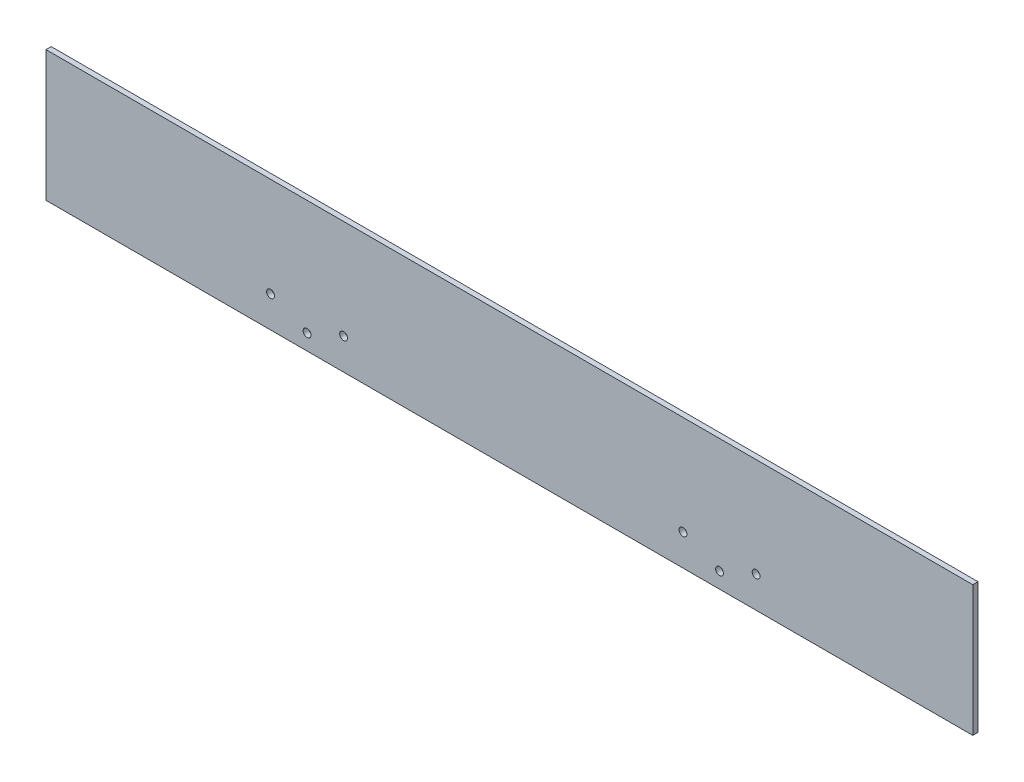
from build123d import *

# Parameters (mm, degrees)
ESQUISSE1_W             = 355
ESQUISSE1_H             = 50
BOSS_EXTRU_1_DEPTH      = 2
ESQUISSE2_R             = 1.5
ENL_V_MAT_EXTRU_1_DEPTH = 180.263074837


with BuildPart() as part:
    # Esquisse1 → Boss.-Extru.1 (new body)
    with BuildSketch(Plane.XY):
        Rectangle(ESQUISSE1_W, ESQUISSE1_H)
    extrude(amount=BOSS_EXTRU_1_DEPTH)

    # Esquisse2 → Enlèv. mat.-Extru.1 (cut, through all)
    with BuildSketch(Plane(origin=(0, 0, 0), x_dir=(-1, 0, 0), z_dir=(0, 0, -1))):
        with Locations((-94.5, -13)):
            Circle(ESQUISSE2_R)
        with Locations((-80.5, -19)):
            Circle(ESQUISSE2_R)
        with Locations((-66.5, -13)):
            Circle(ESQUISSE2_R)
        with Locations((77.5, -19)):
            Circle(ESQUISSE2_R)
        with Locations((63.5, -13)):
            Circle(ESQUISSE2_R)
        with Locations((91.5, -13)):
            Circle(ESQUISSE2_R)
    extrude(amount=-ENL_V_MAT_EXTRU_1_DEPTH, mode=Mode.SUBTRACT)


solid = part.part
